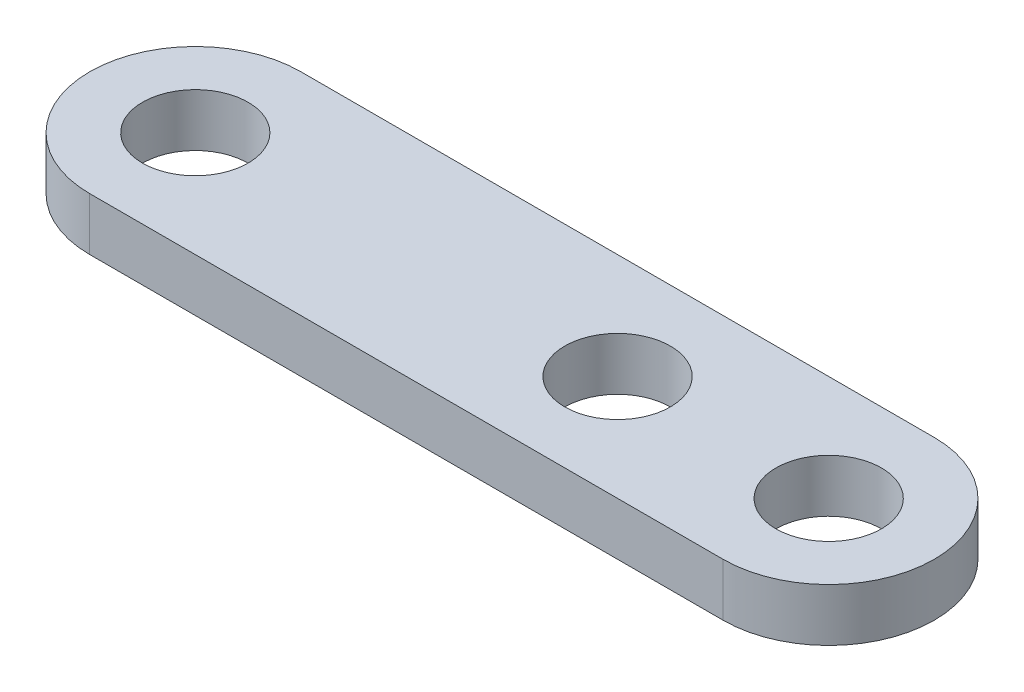
from build123d import *

# Parameters (mm, degrees)
SKETCH1_R           = 5
BOSS_EXTRUDE1_DEPTH = 5
SKETCH2_R           = 5
CUT_EXTRUDE1_DEPTH  = 10


with BuildPart() as part:
    # Sketch1 → Boss-Extrude1 (new body)
    with BuildSketch(Plane(origin=(0, 0, 0), x_dir=(1, 0, 0), z_dir=(0, 1, 0))):
        with BuildLine():
            Line((-72.346809709, 10), (-12.346809709, 10))
            ThreePointArc((-12.346809709, 10), (-2.346809709, 0), (-12.346809709, -10))
            Line((-12.346809709, -10), (-72.346809709, -10))
            ThreePointArc((-72.346809709, -10), (-82.346809709, 0), (-72.346809709, 10))
        make_face()
        with Locations(Location((-72.346809709, 0, 0), (0, 0, 270))):
            Circle(SKETCH1_R, mode=Mode.SUBTRACT)
        with Locations(Location((-12.346809709, 0, 0), (0, 0, 270))):
            Circle(SKETCH1_R, mode=Mode.SUBTRACT)
    extrude(amount=BOSS_EXTRUDE1_DEPTH)

    # Sketch2 → Cut-Extrude1 (cut)
    with BuildSketch(Plane(origin=(0, 5, 0), x_dir=(1, 0, 0), z_dir=(0, 1, 0))):
        with Locations(Location((-32.346809709, 0, 0), (0, 0, 270))):
            Circle(SKETCH2_R)
    extrude(amount=-CUT_EXTRUDE1_DEPTH, mode=Mode.SUBTRACT)


solid = part.part
